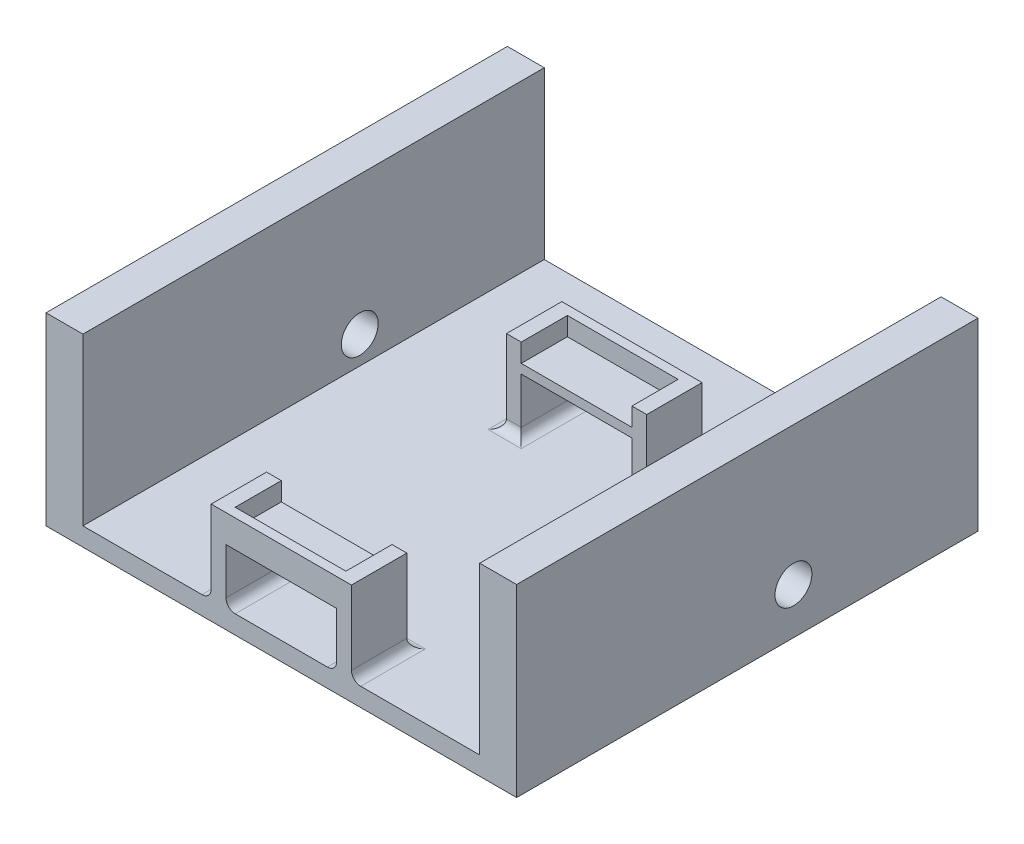
from build123d import *

# Parameters (mm, degrees)
SKETCH_4_W             = 255
SKETCH_4_H             = 250
EXTRUDE_2_DEPTH        = 10
SKETCH_7_W             = 20
SKETCH_7_H             = 250
EXTRUDE_3_DEPTH        = 90
EXTRUDE_4_DEPTH        = 30
CUT_EXTRUDE_1_REACH    = 303.081
SKETCH_9_R             = 10
SKETCH_11_W            = 60
SKETCH_11_H            = 10
EXTRUDE_6_DEPTH        = 5
FILLET_1_R             = 5
FILLET_1_OF_MIRROR_2_R = 5


with BuildPart() as part:
    # 草圖4 → 填料-伸長2 (new body)
    with BuildSketch(Plane(origin=(0, 0, 0), x_dir=(1, 0, 0), z_dir=(0, 1, 0))):
        Rectangle(SKETCH_4_W, SKETCH_4_H)
    extrude(amount=EXTRUDE_2_DEPTH)

    # 草圖7 → 填料-伸長3 (add)
    with BuildSketch(Plane(origin=(0, 10, 0), x_dir=(1, 0, 0), z_dir=(0, 1, 0))):
        with Locations((-117.5, 0)):
            Rectangle(SKETCH_7_W, SKETCH_7_H)
        with Locations((117.5, 0)):
            Rectangle(SKETCH_7_W, SKETCH_7_H)
    extrude(amount=EXTRUDE_3_DEPTH)

    # 草圖8 → 填料-伸長4 (add)
    with BuildSketch(Plane.XY.offset(125)):
        Polygon((-30, 10), (-38, 10), (-38, 55), (-30, 55), (-30, 45), (30, 45), (30, 55), (38, 55), (38, 10), (30, 10), (30, 40), (-30, 40), align=None)
    extrude_4 = extrude(amount=-EXTRUDE_4_DEPTH)

    # 草圖9 → 除料-伸長1 (cut, up to next)
    with BuildSketch(Plane.ZY.offset(127.5), mode=Mode.PRIVATE) as cut_extrude_1_sk1:
        with Locations((-25, 25)):
            Circle(SKETCH_9_R)
    cut_extrude_1_tool1 = extrude(cut_extrude_1_sk1.sketch, amount=-CUT_EXTRUDE_1_REACH, mode=Mode.PRIVATE) & part.part
    cut_extrude_1 = cut_extrude_1_tool1.solids().sort_by_distance((-127.5, 25, -25))[0]
    add(cut_extrude_1, mode=Mode.SUBTRACT)

    # 鏡射1: 除料-伸長1 across plane
    add(cut_extrude_1.mirror(Plane(origin=(0, 0, 0), x_dir=(0, 0, 1), z_dir=(1, 0, 0))), mode=Mode.SUBTRACT)

    # 草圖11 → 填料-伸長6 (add)
    with BuildSketch(Plane.XY.offset(125)):
        with Locations((0, 50)):
            Rectangle(SKETCH_11_W, SKETCH_11_H)
    extrude_6 = extrude(amount=-EXTRUDE_6_DEPTH)

    # 圓角1
    fillet_1_edges = [part.edges().sort_by_distance(p)[0] for p in [
        (-34, 10, 95),
        (-30, 10, 110),
        (-38, 10, 110),
        (34, 10, 95),
        (38, 10, 110),
        (30, 10, 110),
    ]]
    fillet(fillet_1_edges, radius=FILLET_1_R)

    # 鏡射2: 填料-伸長4, 填料-伸長6 across plane
    add(extrude_4.mirror(Plane(origin=(0, 0, 30), x_dir=(1, 0, 0), z_dir=(0, 0, -1))))
    add(extrude_6.mirror(Plane(origin=(0, 0, 30), x_dir=(1, 0, 0), z_dir=(0, 0, -1))))

    # 圓角1 of 鏡射2
    fillet_1_of_mirror_2_edges = [part.edges().sort_by_distance(p)[0] for p in [
        (-34, 10, -35),
        (-30, 10, -50),
        (-38, 10, -50),
        (34, 10, -35),
        (38, 10, -50),
        (30, 10, -50),
    ]]
    fillet(fillet_1_of_mirror_2_edges, radius=FILLET_1_OF_MIRROR_2_R)


solid = part.part
